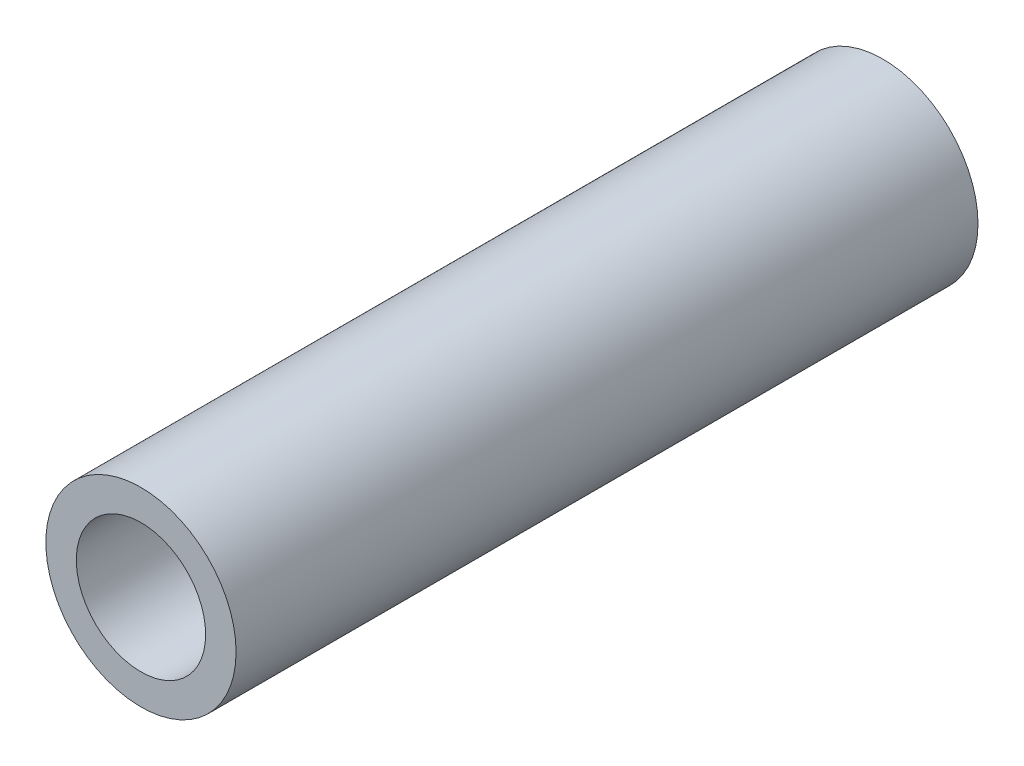
from build123d import *

# Parameters (mm, degrees)
SKETCH_1_R      = 7.5
SKETCH_1_R_2    = 5.1
EXTRUDE_1_DEPTH = 58.5


with BuildPart() as part:
    # 草图1 → 凸台-拉伸1 (new body)
    with BuildSketch(Plane.XY):
        Circle(SKETCH_1_R)
        Circle(SKETCH_1_R_2, mode=Mode.SUBTRACT)
    extrude(amount=EXTRUDE_1_DEPTH)


solid = part.part
